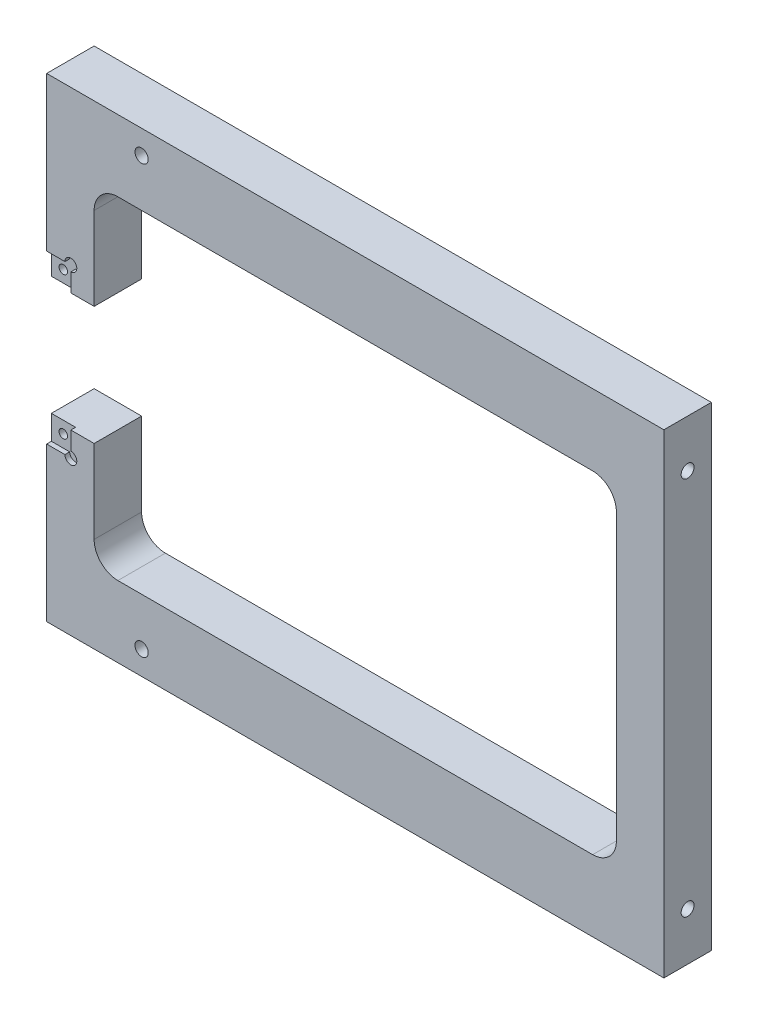
from build123d import *

# Parameters (mm, degrees)
SKETCH1_W                 = 165.1
SKETCH1_H                 = 127
BOSS_EXTRUDE1_DEPTH       = 12.7
CUT_EXTRUDE1_DEPTH        = 105.919218926
SKETCH3_W                 = 6.477
SKETCH3_H                 = 6.477
CUT_EXTRUDE2_DEPTH        = 1.27
SKETCH4_W                 = 6.477
SKETCH4_H                 = 6.477
CUT_EXTRUDE3_DEPTH        = 1.27
F_8_32_TAPPED_HOLE1_D     = 3.4544
F_8_32_TAPPED_HOLE1_DEPTH = 12.7
F_8_32_TAPPED_HOLE1_TIP   = 1.037806461
F_8_32_TAPPED_HOLE2_D     = 3.4544
F_8_32_TAPPED_HOLE2_DEPTH = 12.7
F_8_32_TAPPED_HOLE2_TIP   = 1.037806461
F_8_32_TAPPED_HOLE3_D     = 3.4544
F_8_32_TAPPED_HOLE3_DEPTH = 12.7
F_8_32_TAPPED_HOLE3_TIP   = 1.037806461
F_8_32_TAPPED_HOLE4_D     = 3.4544
F_8_32_TAPPED_HOLE4_DEPTH = 12.7
F_8_32_TAPPED_HOLE4_TIP   = 1.037806461
F_4_40_TAPPED_HOLE1_D     = 2.2606
F_4_40_TAPPED_HOLE2_D     = 2.2606
SKETCH20_R                = 1.778
CUT_EXTRUDE4_DEPTH        = 105.919218926
SKETCH21_R                = 1.778
CUT_EXTRUDE5_DEPTH        = 105.919218926
FILLET4_R                 = 6.35
FILLET5_R                 = 6.35
SKETCH24_R                = 1.5875
CUT_EXTRUDE6_DEPTH        = 1.27


with BuildPart() as part:
    # Sketch1 → Boss-Extrude1 (new body)
    with BuildSketch(Plane.XY):
        Rectangle(SKETCH1_W, SKETCH1_H)
    extrude(amount=BOSS_EXTRUDE1_DEPTH)

    # Sketch2 → Cut-Extrude1 (cut, through all)
    with BuildSketch(Plane.XY):
        Polygon((-82.55, -15.875), (-69.85, -15.875), (-69.85, -44.45), (69.85, -44.45), (69.85, 44.45), (-69.85, 44.45), (-69.85, 15.875), (-82.55, 15.875), align=None)
    extrude(amount=CUT_EXTRUDE1_DEPTH, mode=Mode.SUBTRACT)

    # Sketch3 → Cut-Extrude2 (cut)
    with BuildSketch(Plane.XY.offset(12.7)):
        with Locations((-79.3115, 19.1135)):
            Rectangle(SKETCH3_W, SKETCH3_H)
    extrude(amount=-CUT_EXTRUDE2_DEPTH, mode=Mode.SUBTRACT)

    # Sketch4 → Cut-Extrude3 (cut)
    with BuildSketch(Plane.XY.offset(12.7)):
        with Locations((-79.3115, -19.1135)):
            Rectangle(SKETCH4_W, SKETCH4_H)
    extrude(amount=-CUT_EXTRUDE3_DEPTH, mode=Mode.SUBTRACT)

    # #8-32 Tapped Hole1
    with Locations(Plane.ZY.offset(82.55)):
        with Locations((6.35, 50.8)):
            Hole(F_8_32_TAPPED_HOLE1_D / 2, depth=F_8_32_TAPPED_HOLE1_DEPTH)
            with Locations((0, 0, -(F_8_32_TAPPED_HOLE1_DEPTH + F_8_32_TAPPED_HOLE1_TIP / 2))):  # 118° drill point
                Cone(0, F_8_32_TAPPED_HOLE1_D / 2, F_8_32_TAPPED_HOLE1_TIP, mode=Mode.SUBTRACT)

    # #8-32 Tapped Hole2
    with Locations(Plane.ZY.offset(82.55)):
        with Locations((6.35, -50.689875403)):
            Hole(F_8_32_TAPPED_HOLE2_D / 2, depth=F_8_32_TAPPED_HOLE2_DEPTH)
            with Locations((0, 0, -(F_8_32_TAPPED_HOLE2_DEPTH + F_8_32_TAPPED_HOLE2_TIP / 2))):  # 118° drill point
                Cone(0, F_8_32_TAPPED_HOLE2_D / 2, F_8_32_TAPPED_HOLE2_TIP, mode=Mode.SUBTRACT)

    # #8-32 Tapped Hole3
    with Locations(Plane(origin=(82.55, 0, 0), x_dir=(0, 0, -1), z_dir=(1, 0, 0))):
        with Locations((-6.35, 50.8)):
            Hole(F_8_32_TAPPED_HOLE3_D / 2, depth=F_8_32_TAPPED_HOLE3_DEPTH)
            with Locations((0, 0, -(F_8_32_TAPPED_HOLE3_DEPTH + F_8_32_TAPPED_HOLE3_TIP / 2))):  # 118° drill point
                Cone(0, F_8_32_TAPPED_HOLE3_D / 2, F_8_32_TAPPED_HOLE3_TIP, mode=Mode.SUBTRACT)

    # #8-32 Tapped Hole4
    with Locations(Plane(origin=(82.55, 0, 0), x_dir=(0, 0, -1), z_dir=(1, 0, 0))):
        with Locations((-6.35, -50.689875403)):
            Hole(F_8_32_TAPPED_HOLE4_D / 2, depth=F_8_32_TAPPED_HOLE4_DEPTH)
            with Locations((0, 0, -(F_8_32_TAPPED_HOLE4_DEPTH + F_8_32_TAPPED_HOLE4_TIP / 2))):  # 118° drill point
                Cone(0, F_8_32_TAPPED_HOLE4_D / 2, F_8_32_TAPPED_HOLE4_TIP, mode=Mode.SUBTRACT)

    # #4-40 Tapped Hole1 (through all)
    with Locations(Plane.XY.offset(11.43)):
        with Locations((-79.375, 19.05)):
            Hole(F_4_40_TAPPED_HOLE1_D / 2)

    # #4-40 Tapped Hole2 (through all)
    with Locations(Plane.XY.offset(11.43)):
        with Locations((-79.375, -19.05)):
            Hole(F_4_40_TAPPED_HOLE2_D / 2)

    # Sketch20 → Cut-Extrude4 (cut, through all)
    with BuildSketch(Plane.XY.offset(12.7)):
        with Locations((-57.15, -57.15)):
            Circle(SKETCH20_R)
    extrude(amount=-CUT_EXTRUDE4_DEPTH, mode=Mode.SUBTRACT)

    # Sketch21 → Cut-Extrude5 (cut, through all)
    with BuildSketch(Plane.XY.offset(12.7)):
        with Locations((-57.15, 57.15)):
            Circle(SKETCH21_R)
    extrude(amount=-CUT_EXTRUDE5_DEPTH, mode=Mode.SUBTRACT)

    # Fillet4
    fillet4_edges = [part.edges().sort_by_distance(p)[0] for p in [
        (-69.85, -44.45, 6.35),
    ]]
    fillet(fillet4_edges, radius=FILLET4_R)

    # Fillet5
    fillet5_edges = [part.edges().sort_by_distance(p)[0] for p in [
        (69.85, -44.45, 6.35),
        (69.85, 44.45, 6.35),
        (-69.85, 44.45, 6.35),
    ]]
    fillet(fillet5_edges, radius=FILLET5_R)

    # Sketch24 → Cut-Extrude6 (cut)
    with BuildSketch(Plane.XY.offset(12.7)):
        with Locations((-76.073, -22.352)):
            Circle(SKETCH24_R)
        with Locations((-76.073, 22.352)):
            Circle(SKETCH24_R)
    extrude(amount=-CUT_EXTRUDE6_DEPTH, mode=Mode.SUBTRACT)


solid = part.part
